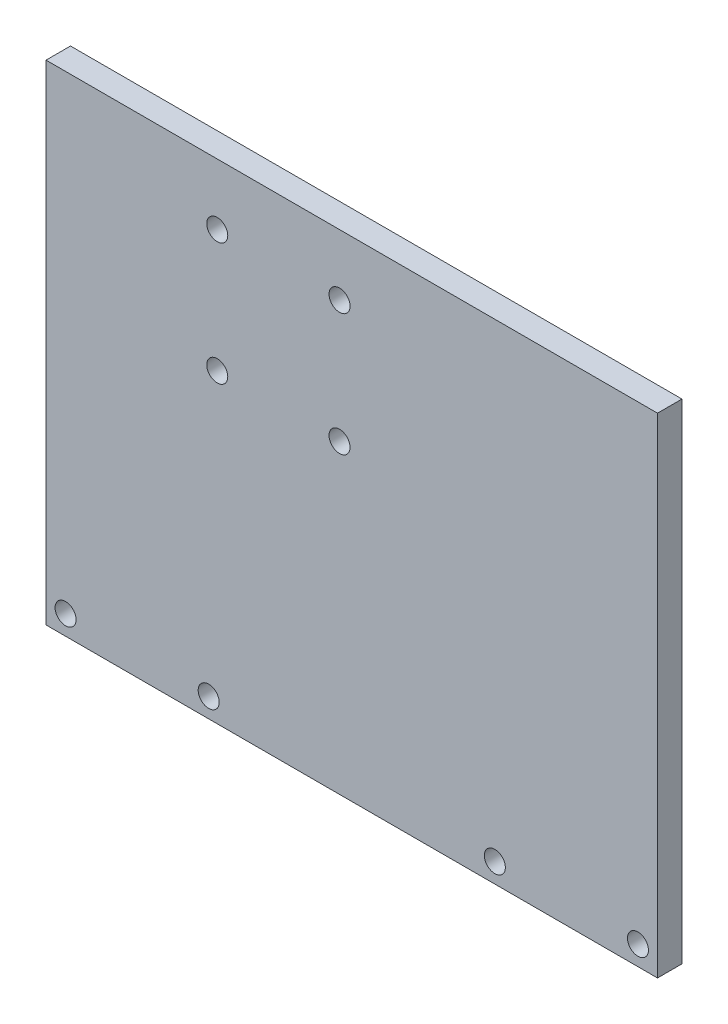
from build123d import *

# Parameters (mm, degrees)
SKETCH1_W           = 125
SKETCH1_H           = 100
SKETCH1_R           = 2.15
BOSS_EXTRUDE1_DEPTH = 2.5


with BuildPart() as part:
    # Sketch1 → Boss-Extrude1 (new, symmetric)
    with BuildSketch(Plane.XY):
        Rectangle(SKETCH1_W, SKETCH1_H)
        with Locations((-27.5, 37.5)):
            Circle(SKETCH1_R, mode=Mode.SUBTRACT)
        with Locations((-2.5, 37.5)):
            Circle(SKETCH1_R, mode=Mode.SUBTRACT)
        with Locations((-2.5, 12.5)):
            Circle(SKETCH1_R, mode=Mode.SUBTRACT)
        with Locations((-27.5, 12.5)):
            Circle(SKETCH1_R, mode=Mode.SUBTRACT)
        with Locations((-58.5, -46)):
            Circle(SKETCH1_R, mode=Mode.SUBTRACT)
        with Locations((58.5, -46)):
            Circle(SKETCH1_R, mode=Mode.SUBTRACT)
        with Locations((-29.25, -46)):
            Circle(SKETCH1_R, mode=Mode.SUBTRACT)
        with Locations((29.25, -46)):
            Circle(SKETCH1_R, mode=Mode.SUBTRACT)
    extrude(amount=BOSS_EXTRUDE1_DEPTH, both=True)


solid = part.part
